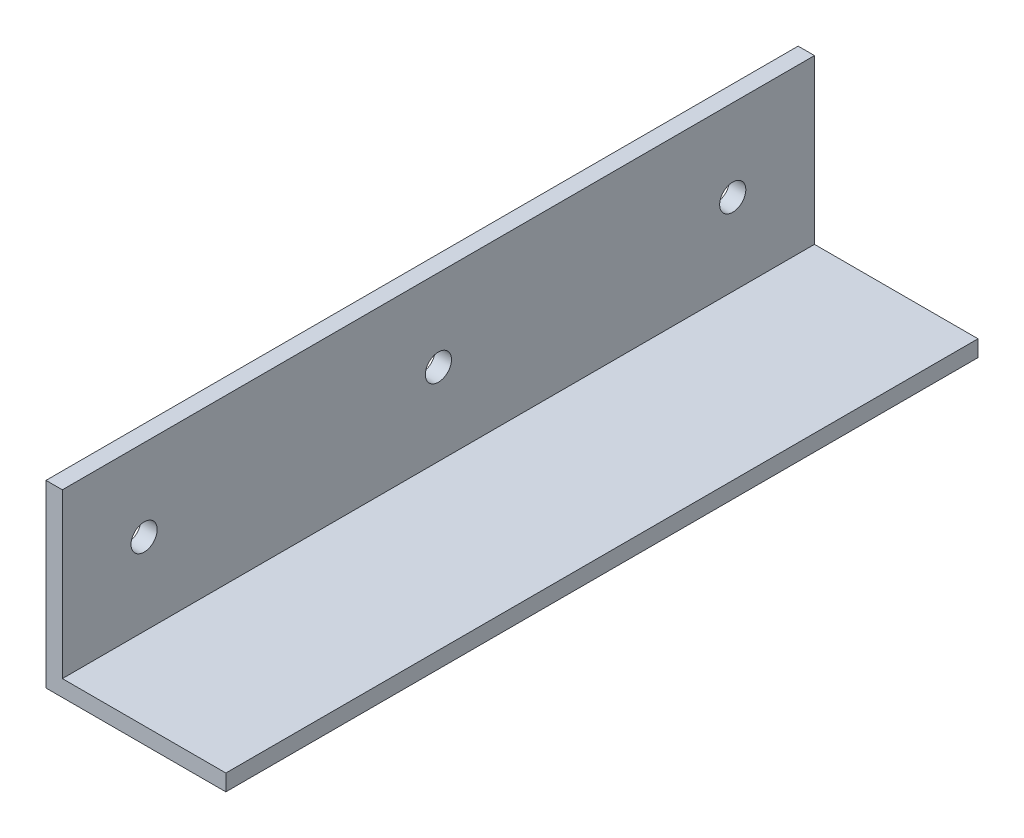
from build123d import *

# Parameters (mm, degrees)
BOSS_EXTRUDE1_DEPTH = 230
SKETCH2_R           = 4
CUT_EXTRUDE1_DEPTH  = 241.62418831


with BuildPart() as part:
    # Sketch1 → Boss-Extrude1 (new body)
    with BuildSketch(Plane.XY):
        Polygon((0, 0), (0, 50), (-5, 50), (-5, 0), (-5, -5), (50, -5), (50, 0), align=None)
    extrude(amount=BOSS_EXTRUDE1_DEPTH)

    # Sketch2 → Cut-Extrude1 (cut, through all)
    with BuildSketch(Plane(origin=(0, 0, 0), x_dir=(0, 0, -1), z_dir=(1, 0, 0))):
        with Locations((-115, 25)):
            Circle(SKETCH2_R)
        with Locations((-25, 25)):
            Circle(SKETCH2_R)
        with Locations((-205, 25)):
            Circle(SKETCH2_R)
    extrude(amount=-CUT_EXTRUDE1_DEPTH, mode=Mode.SUBTRACT)


solid = part.part
